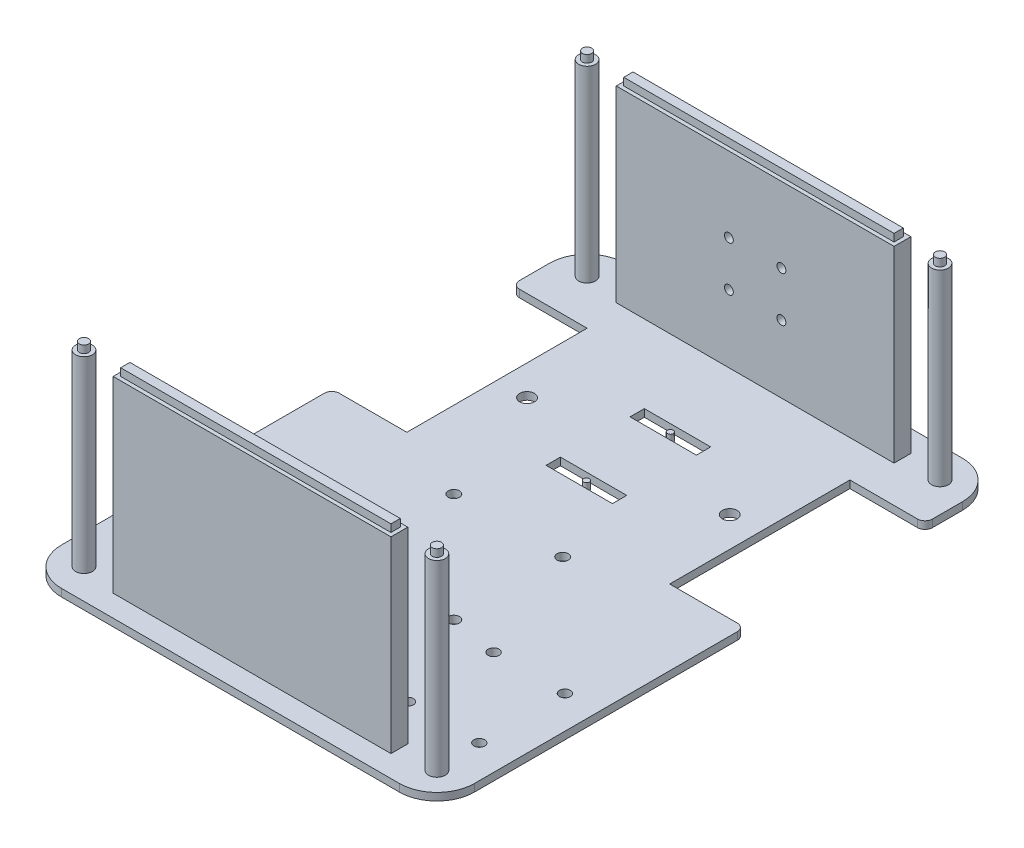
from build123d import *

# Parameters (mm, degrees)
SKETCH2_W                     = 139.7
SKETCH2_H                     = 190.5
BASE_PLATE_DEPTH              = 2.54
SKETCH4_R                     = 1.8415
L_BRACKET_HOLES_DEPTH         = 6.35
SKETCH5_W                     = 25.4
SKETCH5_H                     = 60.96
STEERING_WHEELS_HOLES_DEPTH   = 6.35
FILLET1_R                     = 12.7
FILLET2_R                     = 2.54
SKETCH13_R                    = 1.905
HOLES_FOR_L298_DEPTH          = 6.35
SKETCH14_W                    = 22.44051626
SKETCH14_H                    = 4.83
SKETCH14_R                    = 0.9906
CUT_EXTRUDE4_DEPTH            = 6.35
SKETCH20_W                    = 2.5
SKETCH20_H                    = 2.54
HOLES_FOR_STEERING_AT_2_COUNT = 2
HOLES_FOR_STEERING_AT_2_PITCH = 68.58
SKETCH15_R                    = 2.84
SKETCH15_R_2                  = 1.57
BOSS_EXTRUDE3_DEPTH           = 63.5
SKETCH15_2_R                  = 1.57
BOSS_EXTRUDE4_DEPTH           = 66.04
SKETCH23_R                    = 2.84
SKETCH23_R_2                  = 1.57
BOSS_EXTRUDE5_DEPTH           = 63.5
SKETCH23_2_R                  = 1.57
BOSS_EXTRUDE6_DEPTH           = 66.04
SKETCH24_W                    = 93.98
SKETCH24_H                    = 5.68
BOSS_EXTRUDE7_DEPTH           = 63.5
SKETCH25_W                    = 91.44
SKETCH25_H                    = 3.14
BOSS_EXTRUDE8_DEPTH           = 2.54
SKETCH26_R                    = 1.5
CUT_EXTRUDE5_DEPTH            = 5.68


with BuildPart() as part:
    # Sketch2 → Base Plate (new body)
    with BuildSketch(Plane(origin=(0, 0, 0), x_dir=(1, 0, 0), z_dir=(0, 1, 0))):
        Rectangle(SKETCH2_W, SKETCH2_H)
    extrude(amount=BASE_PLATE_DEPTH)

    # Sketch4 → L-Bracket holes (cut)
    with BuildSketch(Plane(origin=(0, 2.54, 0), x_dir=(1, 0, 0), z_dir=(0, 1, 0))):
        with Locations(Location((-58.79, -69.85, 0), (0, 0, 270))):
            Circle(SKETCH4_R)
        with Locations(Location((-34.66, -69.85, 0), (0, 0, 270))):
            Circle(SKETCH4_R)
        with Locations(Location((-34.66, -40.894, 0), (0, 0, 270))):
            Circle(SKETCH4_R)
        with Locations(Location((-58.79, -40.894, 0), (0, 0, 270))):
            Circle(SKETCH4_R)
        with Locations(Location((34.66, -69.85, 0), (0, 0, 90))):
            Circle(SKETCH4_R)
        with Locations(Location((58.79, -69.85, 0), (0, 0, 90))):
            Circle(SKETCH4_R)
        with Locations(Location((58.79, -40.894, 0), (0, 0, 90))):
            Circle(SKETCH4_R)
        with Locations(Location((34.66, -40.894, 0), (0, 0, 90))):
            Circle(SKETCH4_R)
    extrude(amount=-L_BRACKET_HOLES_DEPTH, mode=Mode.SUBTRACT)

    # Sketch5 → Steering Wheels Holes (cut)
    with BuildSketch(Plane(origin=(0, 2.54, 0), x_dir=(1, 0, 0), z_dir=(0, 1, 0))):
        with Locations((-57.15, 39.37)):
            Rectangle(SKETCH5_W, SKETCH5_H)
        with Locations((57.15, 39.37)):
            Rectangle(SKETCH5_W, SKETCH5_H)
    extrude(amount=-STEERING_WHEELS_HOLES_DEPTH, mode=Mode.SUBTRACT)

    # Fillet1
    fillet1_edges = [part.edges().sort_by_distance(p)[0] for p in [
        (69.85, 1.27, 95.25),
        (-69.85, 1.27, 95.25),
        (-69.85, 1.27, -95.25),
        (69.85, 1.27, -95.25),
    ]]
    fillet(fillet1_edges, radius=FILLET1_R)

    # Fillet2
    fillet2_edges = [part.edges().sort_by_distance(p)[0] for p in [
        (-69.85, 1.27, -8.89),
        (-69.85, 1.27, -69.85),
        (69.85, 1.27, -69.85),
        (69.85, 1.27, -8.89),
    ]]
    fillet(fillet2_edges, radius=FILLET2_R)

    # Sketch13 → Holes for L298 (cut)
    with BuildSketch(Plane(origin=(0, 2.54, 0), x_dir=(1, 0, 0), z_dir=(0, 1, 0))):
        with Locations(Location((-18.415, -1.27, 0), (0, 0, 270))):
            Circle(SKETCH13_R)
        with Locations(Location((-18.415, -38.1, 0), (0, 0, 270))):
            Circle(SKETCH13_R)
        with Locations(Location((18.415, -38.1, 0), (0, 0, 270))):
            Circle(SKETCH13_R)
        with Locations(Location((18.415, -1.27, 0), (0, 0, 270))):
            Circle(SKETCH13_R)
    extrude(amount=-HOLES_FOR_L298_DEPTH, mode=Mode.SUBTRACT)

    # Sketch14 → Cut-Extrude4 (cut)
    # profile 1 of 2: a face of its own
    with BuildSketch(Plane(origin=(0, 2.54, 0), x_dir=(1, 0, 0), z_dir=(0, 1, 0))):
        with Locations((0, 53.57)):
            Rectangle(SKETCH14_W, SKETCH14_H)
        with Locations(Location((0, 53.57, 0), (0, 0, 90))):
            Circle(SKETCH14_R, mode=Mode.SUBTRACT)
    # profile 2 of 2: a face of its own
    with BuildSketch(Plane(origin=(0, 2.54, 0), x_dir=(1, 0, 0), z_dir=(0, 1, 0))):
        with Locations((0, 25.17)):
            Rectangle(SKETCH14_W, SKETCH14_H)
        with Locations(Location((0, 25.17, 0), (0, 0, 270))):
            Circle(SKETCH14_R, mode=Mode.SUBTRACT)
    extrude(amount=-CUT_EXTRUDE4_DEPTH, mode=Mode.SUBTRACT)


with BuildPart() as cut_extrude4_piece_1:
    # of the separate pieces the step leaves, piece 1, a body of its own (cut_extrude4_pieces)
    add(part.part.solids().sort_by_distance((-69.85, 0, -6.35))[0])

    # Sketch20 → holes for steering (revolve, cut)
    with BuildSketch(Plane(origin=(-34.29, 2.54, -39.37), x_dir=(0, 0, 1), z_dir=(1, 0, 0))):
        with Locations((1.25, 1.27)):
            Rectangle(SKETCH20_W, SKETCH20_H)
    holes_for_steering = revolve(axis=Axis((-34.29, 8.89, -39.37), (0, -1, 0)), mode=Mode.SUBTRACT)

    # holes for steering at 2: holes for steering ×2
    with Locations(*[(i * HOLES_FOR_STEERING_AT_2_PITCH, 0, 0) for i in range(1, HOLES_FOR_STEERING_AT_2_COUNT)]):
        add(holes_for_steering, mode=Mode.SUBTRACT)

    # Sketch15 → Boss-Extrude3 (add)
    with BuildSketch(Plane(origin=(0, 2.54, 0), x_dir=(1, 0, 0), z_dir=(0, 1, 0))):
        with Locations(Location((-59.69, 85.09, 0), (0, 0, 90))):
            Circle(SKETCH15_R)
        with Locations(Location((-59.69, 85.09, 0), (0, 0, 270))):
            Circle(SKETCH15_R_2, mode=Mode.SUBTRACT)
    boss_extrude3 = extrude(amount=BOSS_EXTRUDE3_DEPTH)

    # Sketch15<2> → Boss-Extrude4 (add)
    with BuildSketch(Plane(origin=(0, 2.54, 0), x_dir=(1, 0, 0), z_dir=(0, 1, 0))):
        with Locations(Location((-59.69, 85.09, 0), (0, 0, 270))):
            Circle(SKETCH15_2_R)
    boss_extrude4 = extrude(amount=BOSS_EXTRUDE4_DEPTH)

    # Mirror1: Boss-Extrude4 across plane
    add(boss_extrude4.mirror(Plane(origin=(0, 0, 0), x_dir=(0, 0, 1), z_dir=(1, 0, 0))))

    # Mirror2: Boss-Extrude3 across plane
    add(boss_extrude3.mirror(Plane(origin=(0, 0, 0), x_dir=(0, 0, 1), z_dir=(1, 0, 0))))

    # Sketch23 → Boss-Extrude5 (add)
    with BuildSketch(Plane(origin=(0, 2.54, 0), x_dir=(1, 0, 0), z_dir=(0, 1, 0))):
        with Locations(Location((-59.69, -85.09, 0), (0, 0, 90))):
            Circle(SKETCH23_R)
        with Locations(Location((-59.69, -85.09, 0), (0, 0, 270))):
            Circle(SKETCH23_R_2, mode=Mode.SUBTRACT)
    boss_extrude5 = extrude(amount=BOSS_EXTRUDE5_DEPTH)

    # Sketch23<2> → Boss-Extrude6 (add)
    with BuildSketch(Plane(origin=(0, 2.54, 0), x_dir=(1, 0, 0), z_dir=(0, 1, 0))):
        with Locations(Location((-59.69, -85.09, 0), (0, 0, 270))):
            Circle(SKETCH23_2_R)
    boss_extrude6 = extrude(amount=BOSS_EXTRUDE6_DEPTH)

    # Mirror3: Boss-Extrude5, Boss-Extrude6 across plane
    add(boss_extrude5.mirror(Plane(origin=(0, 0, 0), x_dir=(0, 0, 1), z_dir=(1, 0, 0))))
    add(boss_extrude6.mirror(Plane(origin=(0, 0, 0), x_dir=(0, 0, 1), z_dir=(1, 0, 0))))

    # Sketch24 → Boss-Extrude7 (add)
    with BuildSketch(Plane(origin=(0, 2.54, 0), x_dir=(1, 0, 0), z_dir=(0, 1, 0))):
        with Locations((0, -85.09)):
            Rectangle(SKETCH24_W, SKETCH24_H)
        with Locations((0, 85.09)):
            Rectangle(SKETCH24_W, SKETCH24_H)
    extrude(amount=BOSS_EXTRUDE7_DEPTH)

    # Sketch25 → Boss-Extrude8 (add)
    with BuildSketch(Plane(origin=(0, 66.04, 0), x_dir=(1, 0, 0), z_dir=(0, 1, 0))):
        with Locations((0, -85.09)):
            Rectangle(SKETCH25_W, SKETCH25_H)
        with Locations((0, 85.09)):
            Rectangle(SKETCH25_W, SKETCH25_H)
    extrude(amount=BOSS_EXTRUDE8_DEPTH)

    # Sketch26 → Cut-Extrude5 (cut)
    with BuildSketch(Plane(origin=(0, 0, -87.93), x_dir=(-1, 0, 0), z_dir=(0, 0, -1))):
        with Locations((-8.89, 40.64)):
            Circle(SKETCH26_R)
        with Locations((-8.89, 25.4)):
            Circle(SKETCH26_R)
        with Locations((8.89, 25.4)):
            Circle(SKETCH26_R)
        with Locations((8.89, 40.64)):
            Circle(SKETCH26_R)
    extrude(amount=-CUT_EXTRUDE5_DEPTH, mode=Mode.SUBTRACT)


with BuildPart() as cut_extrude4_piece_2:
    # of the separate pieces the step leaves, piece 2, a body of its own (cut_extrude4_pieces)
    add(part.part.solids().sort_by_distance((0, 0, -54.5606))[0])


with BuildPart() as cut_extrude4_piece_3:
    # of the separate pieces the step leaves, piece 3, a body of its own (cut_extrude4_pieces)
    add(part.part.solids().sort_by_distance((0, 0, -24.1794))[0])


solid = Compound([cut_extrude4_piece_1.part, cut_extrude4_piece_2.part, cut_extrude4_piece_3.part])
